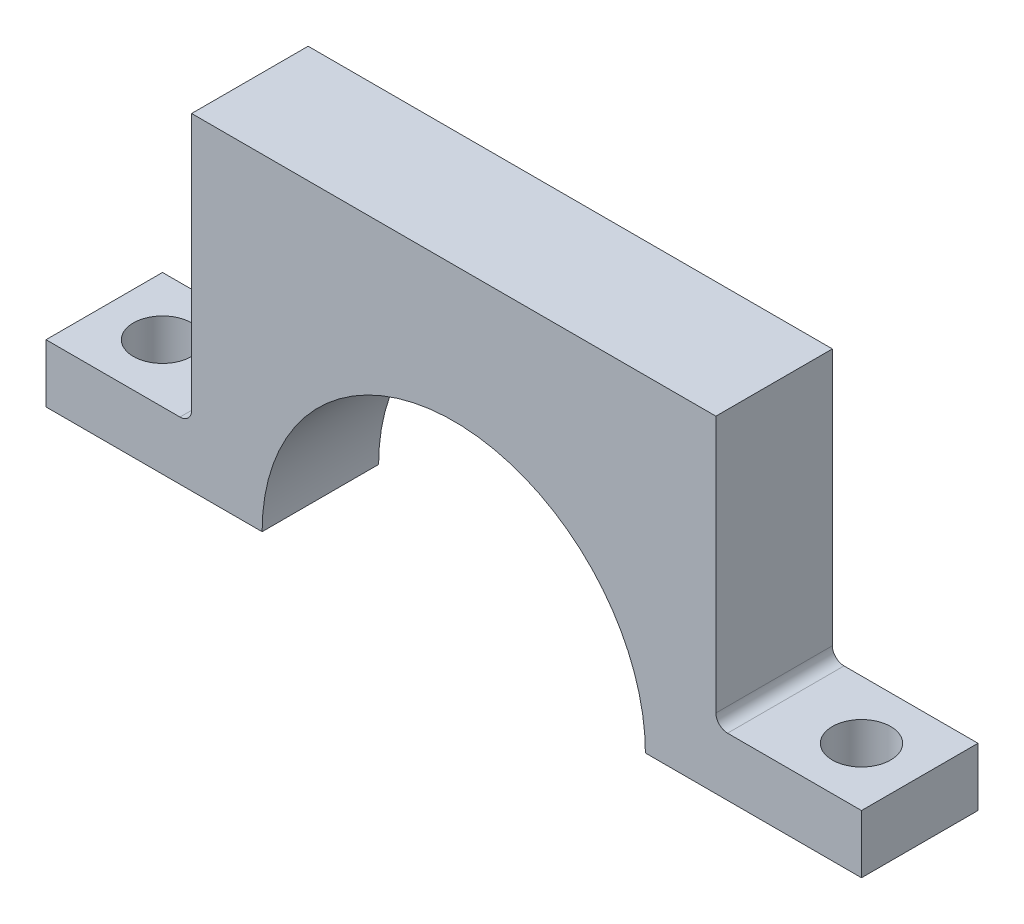
from build123d import *

# Parameters (mm, degrees)
EXTRUDE_1_DEPTH = 5
SKETCH_2_W      = 12.5
SKETCH_2_H      = 10
SKETCH_2_R      = 2.5
EXTRUDE_2_DEPTH = 5
FILLET_1_R      = 1


with BuildPart() as part:
    # 草图1 → 凸台-拉伸1 (new, symmetric)
    with BuildSketch(Plane.XY):
        with BuildLine():
            Line((16.45, 0), (22.5, 0))
            Line((22.5, 0), (22.5, 28.066706708))
            Line((22.5, 28.066706708), (-22.5, 28.066706708))
            Line((-22.5, 28.066706708), (-22.5, 0))
            Line((-22.5, 0), (-16.45, 0))
            ThreePointArc((-16.45, 0), (0, 16.45), (16.45, 0))
        make_face()
    extrude(amount=EXTRUDE_1_DEPTH, both=True)

    # 草图2 → 凸台-拉伸2 (add)
    # profile 1 of 2: a face of its own
    with BuildSketch(Plane.XZ):
        with Locations((-28.75, 0)):
            Rectangle(SKETCH_2_W, SKETCH_2_H)
        with Locations((-30, 0)):
            Circle(SKETCH_2_R, mode=Mode.SUBTRACT)
    # profile 2 of 2: a face of its own
    with BuildSketch(Plane.XZ):
        with Locations((28.75, 0)):
            Rectangle(SKETCH_2_W, SKETCH_2_H)
        with Locations(Location((30, 0, 0), (0, 0, 180))):
            Circle(SKETCH_2_R, mode=Mode.SUBTRACT)
    extrude(amount=-EXTRUDE_2_DEPTH)

    # 圆角1
    fillet_1_edges = [part.edges().sort_by_distance(p)[0] for p in [
        (22.5, 5, 0),
        (-22.5, 5, 0),
    ]]
    fillet(fillet_1_edges, radius=FILLET_1_R)


solid = part.part
